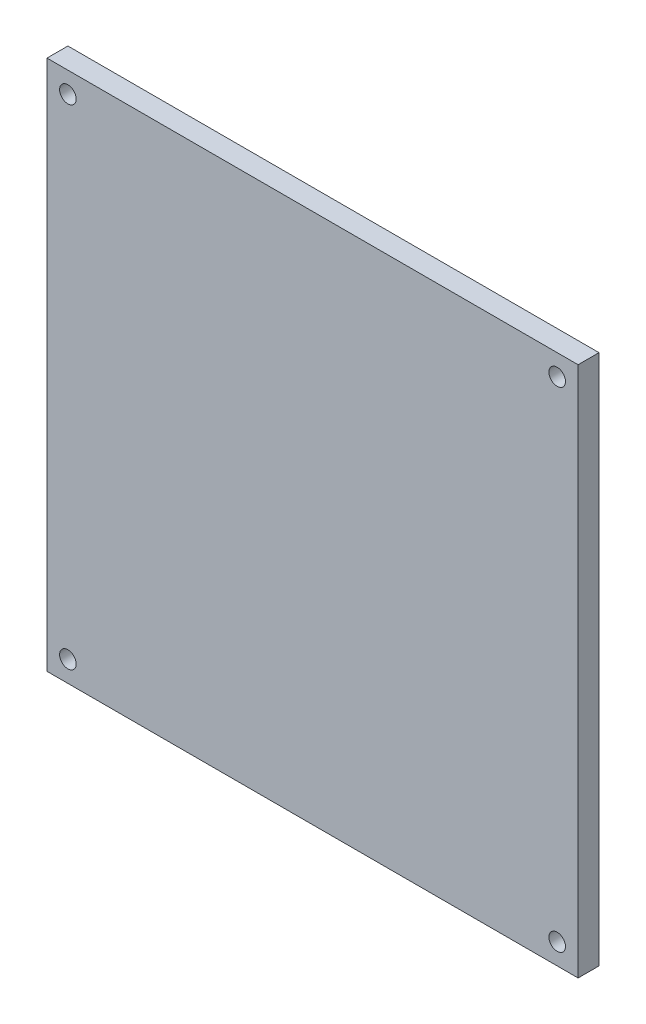
from build123d import *

# Parameters (mm, degrees)
SKETCH_2_W      = 127
SKETCH_2_H      = 127
EXTRUDE_1_DEPTH = 5


with BuildPart() as part:
    # Эскиз2 → Бобышка-Вытянуть1 (new body)
    with BuildSketch(Plane.XY):
        with Locations((58.5, 58.5)):
            Rectangle(SKETCH_2_W, SKETCH_2_H)
        with BuildLine():
            ThreePointArc((-1.981, 0), (0, -1.981), (1.981, 0))
            ThreePointArc((1.981, 0), (0, 1.981), (-1.981, 0))
        make_face(mode=Mode.SUBTRACT)
        with BuildLine():
            ThreePointArc((115.019, 0), (117, -1.981), (118.981, 0))
            ThreePointArc((118.981, 0), (117, 1.981), (115.019, 0))
        make_face(mode=Mode.SUBTRACT)
        with BuildLine():
            ThreePointArc((115.019, 117), (117, 115.019), (118.981, 117))
            ThreePointArc((118.981, 117), (117, 118.981), (115.019, 117))
        make_face(mode=Mode.SUBTRACT)
        with BuildLine():
            ThreePointArc((-1.981, 117), (0, 115.019), (1.981, 117))
            ThreePointArc((1.981, 117), (0, 118.981), (-1.981, 117))
        make_face(mode=Mode.SUBTRACT)
    extrude(amount=EXTRUDE_1_DEPTH)


solid = part.part
